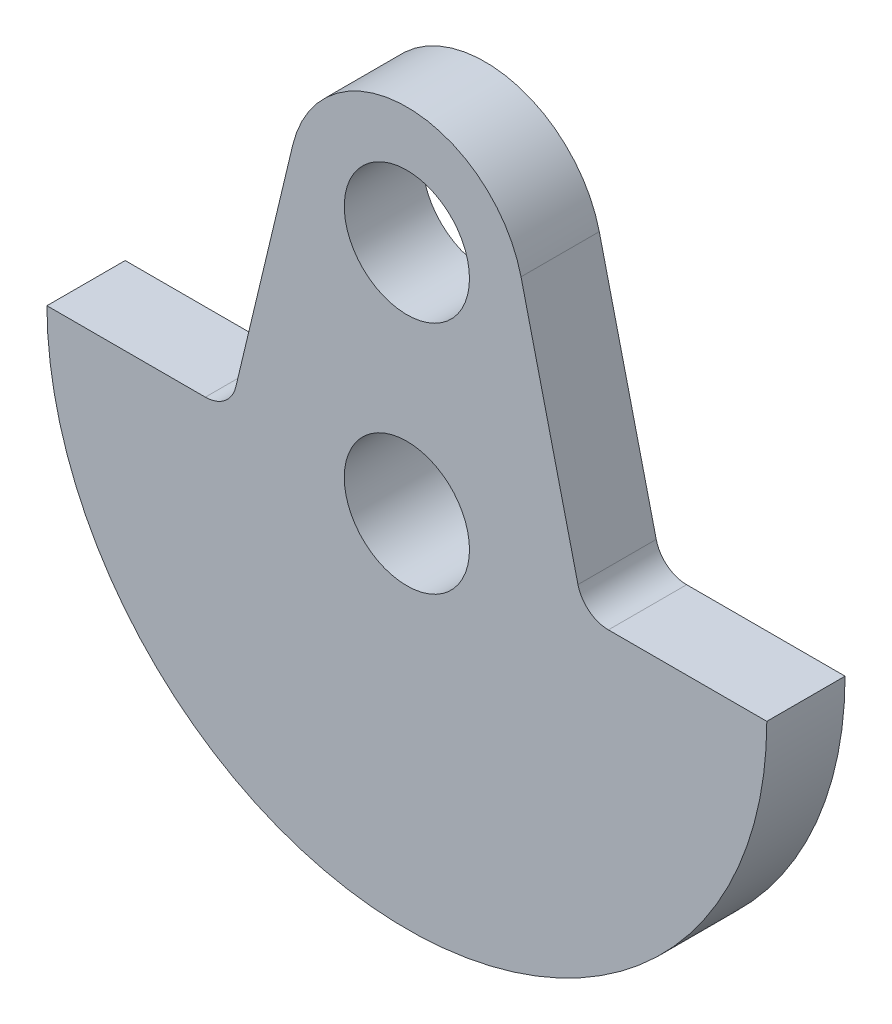
from build123d import *
from build123d.topology import SkipClean

# Parameters (mm, degrees)
SKETCH1_R           = 4
BOSS_EXTRUDE1_DEPTH = 5
BOSS_EXTRUDE2_START = 1
SKETCH3_R           = 6
SKETCH3_R_2         = 4
BOSS_EXTRUDE2_DEPTH = 1


with BuildPart() as part:
    # Sketch1 → Boss-Extrude1 (new body)
    with BuildSketch(Plane.XY):
        with BuildLine():
            Line((-23, -15), (-12.87798214, -15))
            ThreePointArc((-12.87798214, -15), (-11.639160434, -14.570134001), (-10.932866059, -13.465320781))
            Line((-10.932866059, -13.465320781), (-7.294185306, 1.74495293))
            ThreePointArc((-7.294185306, 1.74495293), (0, 7.5), (7.294185306, 1.74495293))
            Line((7.294185306, 1.74495293), (10.932866059, -13.465320781))
            ThreePointArc((10.932866059, -13.465320781), (11.639160434, -14.570134001), (12.87798214, -15))
            Line((12.87798214, -15), (23, -15))
            ThreePointArc((23, -15), (0, -38), (-23, -15))
        make_face()
        Circle(SKETCH1_R, mode=Mode.SUBTRACT)
        with Locations((0, -15)):
            Circle(SKETCH1_R, mode=Mode.SUBTRACT)
    extrude(amount=BOSS_EXTRUDE1_DEPTH)

    # Sketch3 → Boss-Extrude2 (add)
    with SkipClean():  # the faces are left unmerged after this step: merging them gives an invalid solid
        with BuildSketch(Plane(origin=(0, 0, 0), x_dir=(-1, 0, 0), z_dir=(0, 0, -1)).offset(BOSS_EXTRUDE2_START)):
            with Locations(Location((0, -15, 0), (0, 0, 180))):
                Circle(SKETCH3_R)
            with Locations((0, -15)):
                Circle(SKETCH3_R_2, mode=Mode.SUBTRACT)
        extrude(amount=-BOSS_EXTRUDE2_DEPTH)


solid = part.part
